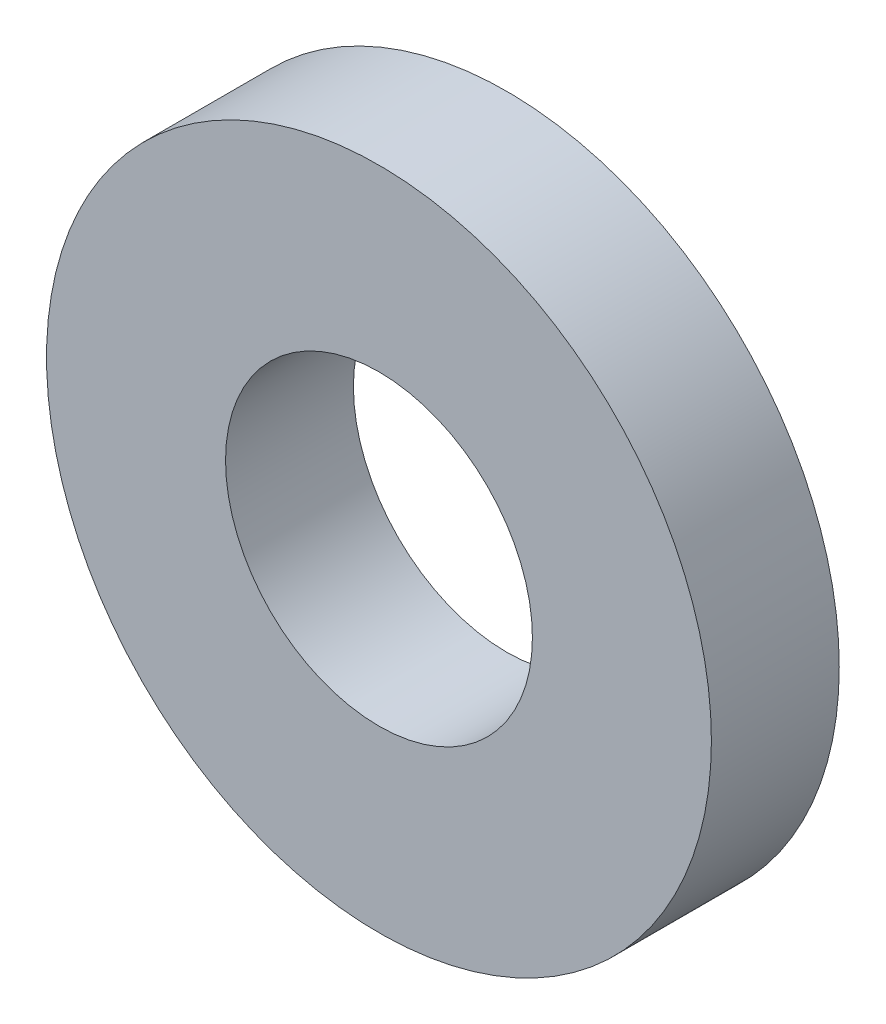
from build123d import *

# Parameters (mm, degrees)
SKETCH1_R           = 6.5
SKETCH1_R_2         = 3
BOSS_EXTRUDE1_DEPTH = 2.5


with BuildPart() as part:
    # Sketch1 → Boss-Extrude1 (new body)
    with BuildSketch(Plane.XY):
        Circle(SKETCH1_R)
        Circle(SKETCH1_R_2, mode=Mode.SUBTRACT)
    extrude(amount=BOSS_EXTRUDE1_DEPTH)


solid = part.part
